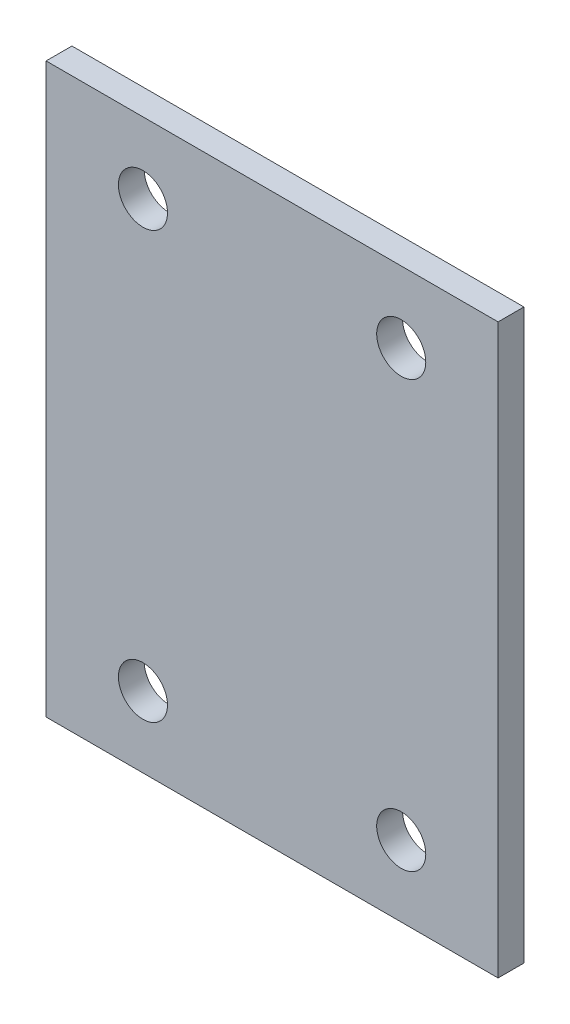
from build123d import *

# Parameters (mm, degrees)
SKETCH_1_W      = 350
SKETCH_1_H      = 440
SKETCH_1_R      = 19
EXTRUDE_1_DEPTH = 20


with BuildPart() as part:
    # Эскиз1 → Бобышка-Вытянуть1 (new body)
    with BuildSketch(Plane.XY):
        Rectangle(SKETCH_1_W, SKETCH_1_H)
        with Locations((-100, 165)):
            Circle(SKETCH_1_R, mode=Mode.SUBTRACT)
        with Locations((100, 165)):
            Circle(SKETCH_1_R, mode=Mode.SUBTRACT)
        with Locations((100, -165)):
            Circle(SKETCH_1_R, mode=Mode.SUBTRACT)
        with Locations((-100, -165)):
            Circle(SKETCH_1_R, mode=Mode.SUBTRACT)
    extrude(amount=EXTRUDE_1_DEPTH)


solid = part.part
